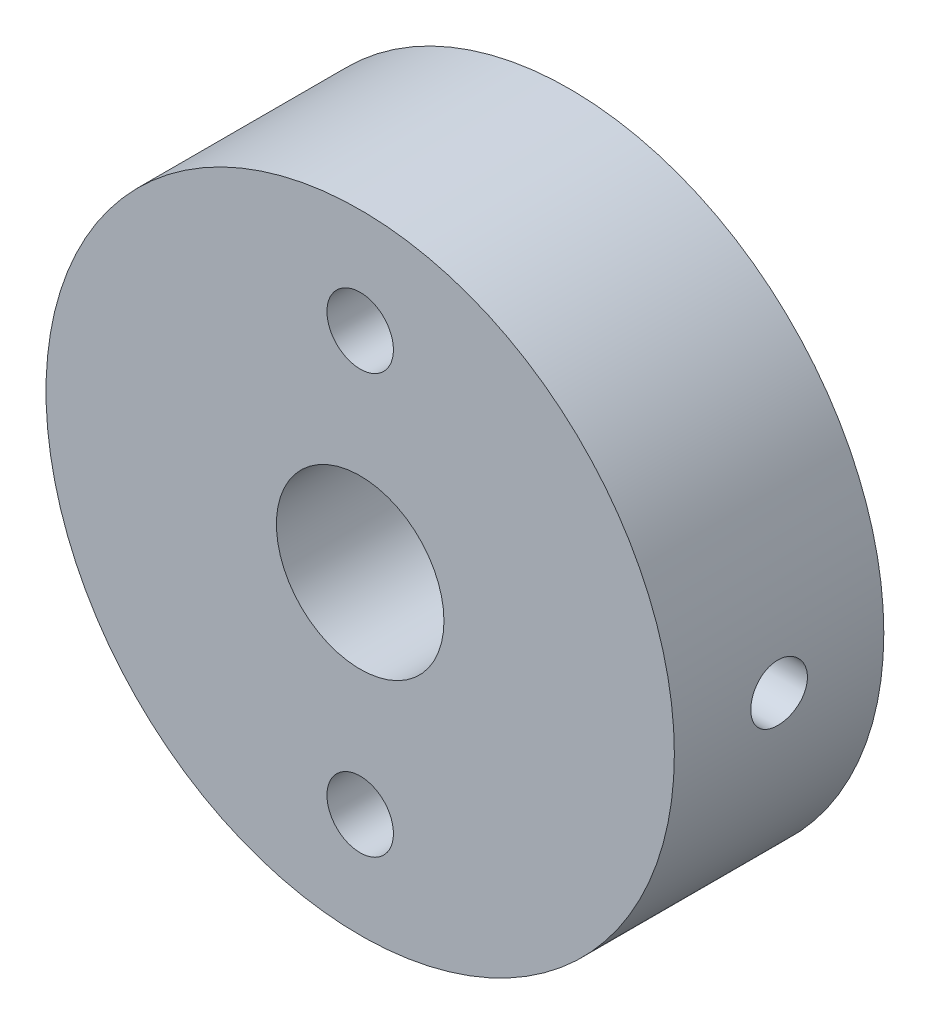
from build123d import *

# Parameters (mm, degrees)
SKETCH1_R                 = 15
SKETCH1_R_2               = 1.5875
SKETCH1_R_3               = 4
BOSS_EXTRUDE2_DEPTH       = 10
F_6_32_TAPPED_HOLE1_D     = 2.7051
F_6_32_TAPPED_HOLE1_DEPTH = 14.999
F_6_32_TAPPED_HOLE1_TIP   = 0.81269403


with BuildPart() as part:
    # Sketch1 → Boss-Extrude2 (new body)
    with BuildSketch(Plane.XY):
        Circle(SKETCH1_R)
        with Locations((0, 10)):
            Circle(SKETCH1_R_2, mode=Mode.SUBTRACT)
        Circle(SKETCH1_R_3, mode=Mode.SUBTRACT)
        with Locations((0, -10)):
            Circle(SKETCH1_R_2, mode=Mode.SUBTRACT)
    extrude(amount=BOSS_EXTRUDE2_DEPTH)

    # #6-32 Tapped Hole1
    with Locations(Plane(origin=(15, 0, 4.999999906), x_dir=(0, 1, 0), z_dir=(1, 0, 0))):
        with Locations((0, 0)):
            Hole(F_6_32_TAPPED_HOLE1_D / 2, depth=F_6_32_TAPPED_HOLE1_DEPTH)
            with Locations((0, 0, -(F_6_32_TAPPED_HOLE1_DEPTH + F_6_32_TAPPED_HOLE1_TIP / 2))):  # 118° drill point
                Cone(0, F_6_32_TAPPED_HOLE1_D / 2, F_6_32_TAPPED_HOLE1_TIP, mode=Mode.SUBTRACT)


solid = part.part
